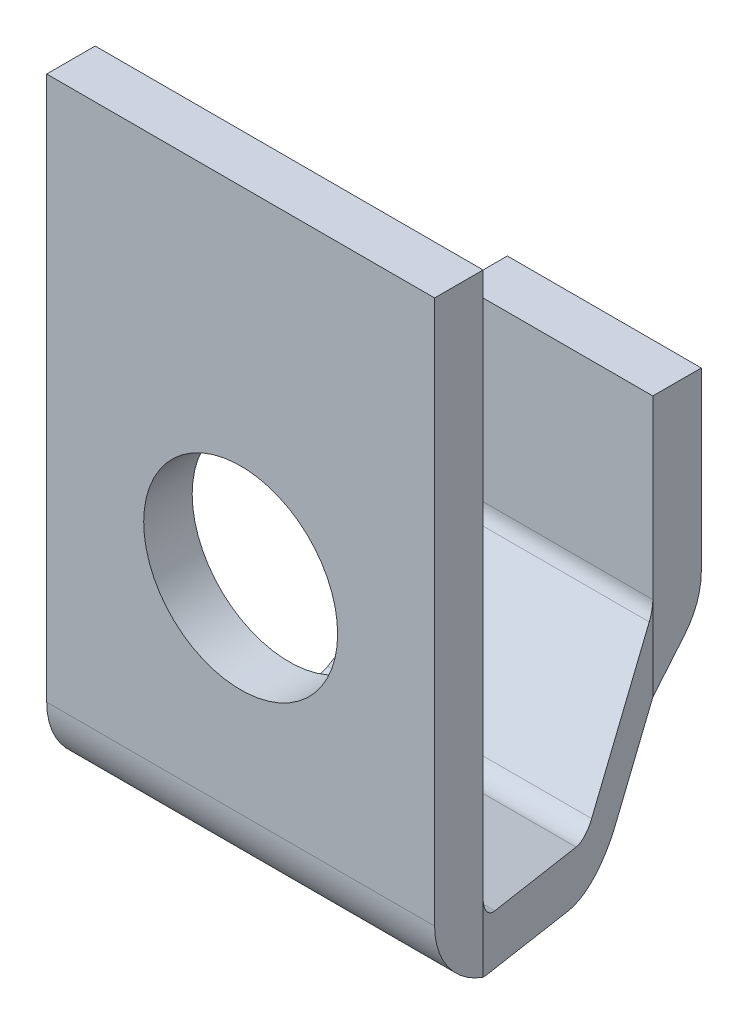
from build123d import *

# Parameters (mm, degrees)
SKETCH1_W          = 4
SKETCH1_H          = 0.5
SKETCH6_OUTSIDE_W  = 7.73
SKETCH6_OUTSIDE_H  = 7.48
CUT_EXTRUDE1_DEPTH = 8.809622956
SKETCH7_R          = 1
CUT_EXTRUDE2_DEPTH = 0.5


with BuildPart() as part:
    # Sweep1: sweep along a path in Sketch2
    with BuildLine(Plane(origin=(0, 0, 0), x_dir=(0, 0, -1), z_dir=(1, 0, 0))) as sweep1_path:
        Line((0, 0), (0, -5.609611797))
        ThreePointArc((0, -5.609611797), (0.105897281, -5.917317901), (0.378732187, -6.094683047))
        Line((0.378732187, -6.094683047), (1.695534419, -6.423883605))
        ThreePointArc((1.695534419, -6.423883605), (1.971967014, -6.414126872), (2.200912871, -6.258904554))
        Line((2.200912871, -6.258904554), (3.13411064, -5.139067232))
        ThreePointArc((3.13411064, -5.139067232), (3.220135789, -4.989187664), (3.25, -4.818975032))
        Line((3.25, -4.818975032), (3.25, -3))
    # Sketch1 → Sweep1 (sweep)
    with BuildSketch(Plane(origin=(0, 0, 0), x_dir=(1, 0, 0), z_dir=(0, 1, 0))):
        Rectangle(SKETCH1_W, SKETCH1_H)
    sweep(path=sweep1_path.line)

    # Sketch6 outside → Cut-Extrude1 (cut, through all)
    with BuildSketch(Plane(origin=(0, 0, 0), x_dir=(1, 0, 0), z_dir=(0, 1, 0))):
        with Locations((0, 1.625)):
            Rectangle(SKETCH6_OUTSIDE_W, SKETCH6_OUTSIDE_H)
        Polygon((2, -0.25), (-2, -0.25), (-2, 0.25), (-1, 3), (-1, 3.5), (1, 3.5), (1, 3), (2, 0.25), align=None, mode=Mode.SUBTRACT)
    extrude(amount=-CUT_EXTRUDE1_DEPTH, mode=Mode.SUBTRACT)

    # Sketch7 → Cut-Extrude2 (cut)
    with BuildSketch(Plane.XY.offset(0.25)):
        with Locations((0, -3.5)):
            Circle(SKETCH7_R)
    extrude(amount=-CUT_EXTRUDE2_DEPTH, mode=Mode.SUBTRACT)


solid = part.part
